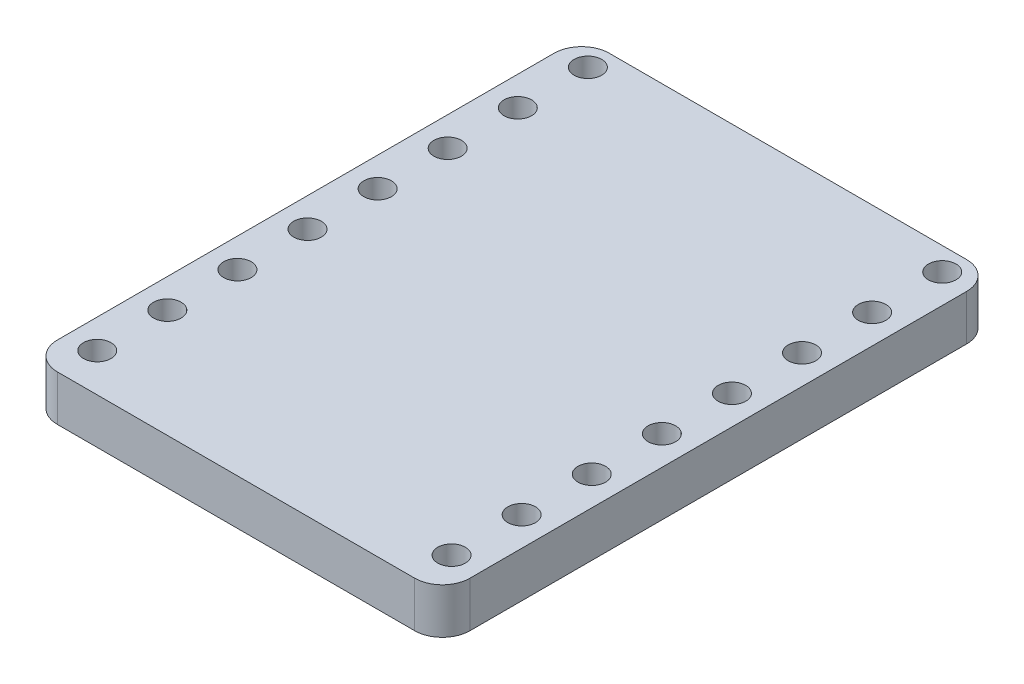
from build123d import *

# Parameters (mm, degrees)
SKETCH1_W            = 17.92
SKETCH1_H            = 22.86
BOSS_EXTRUDE1_DEPTH  = 0.825
SKETCH3_R            = 0.5
CUT_EXTRUDE1_DEPTH   = 15.546722139
LPATTERN1_COUNT      = 8
LPATTERN1_PITCH      = 2.54
LPATTERN1_COUNT_DIR2 = 2
LPATTERN1_PITCH_DIR2 = 12.84
SKETCH4_W            = 18.95
SKETCH4_H            = 24
SKETCH4_W_2          = 14.95
SKETCH4_H_2          = 20
CUT_EXTRUDE2_DEPTH   = 15.616736982
FILLET1_R            = 1


with BuildPart() as part:
    # Sketch1 → Boss-Extrude1 (new, symmetric)
    with BuildSketch(Plane(origin=(0, 0, 0), x_dir=(1, 0, 0), z_dir=(0, 1, 0))):
        Rectangle(SKETCH1_W, SKETCH1_H)
    extrude(amount=BOSS_EXTRUDE1_DEPTH, both=True)

    # Sketch3 → Cut-Extrude1 (cut, symmetric)
    with BuildSketch(Plane(origin=(0, 0, 0), x_dir=(1, 0, 0), z_dir=(0, 1, 0))):
        with Locations(Location((-6.42, -8.89, 0), (0, 0, 270))):
            Circle(SKETCH3_R)
    cut_extrude1 = extrude(amount=CUT_EXTRUDE1_DEPTH, both=True, mode=Mode.SUBTRACT)

    # LPattern1: Cut-Extrude1 8 × 2
    with Locations(*[(j * LPATTERN1_PITCH_DIR2, 0, -i * LPATTERN1_PITCH) for i in range(LPATTERN1_COUNT) for j in range(LPATTERN1_COUNT_DIR2) if (i, j) != (0, 0)]):
        add(cut_extrude1, mode=Mode.SUBTRACT)

    # Sketch4 → Cut-Extrude2 (cut, through all)
    with BuildSketch(Plane(origin=(0, 0.825, 0), x_dir=(1, 0, 0), z_dir=(0, 1, 0))):
        with Locations((0, -0.28)):
            Rectangle(SKETCH4_W, SKETCH4_H)
        with Locations((0, -0.28)):
            Rectangle(SKETCH4_W_2, SKETCH4_H_2, mode=Mode.SUBTRACT)
    extrude(amount=-CUT_EXTRUDE2_DEPTH, mode=Mode.SUBTRACT)

    # Fillet1
    fillet1_edges = [part.edges().sort_by_distance(p)[0] for p in [
        (-7.475, 0, -9.72),
        (7.475, 0, -9.72),
        (7.475, 0, 10.28),
        (-7.475, 0, 10.28),
    ]]
    fillet(fillet1_edges, radius=FILLET1_R)


solid = part.part
